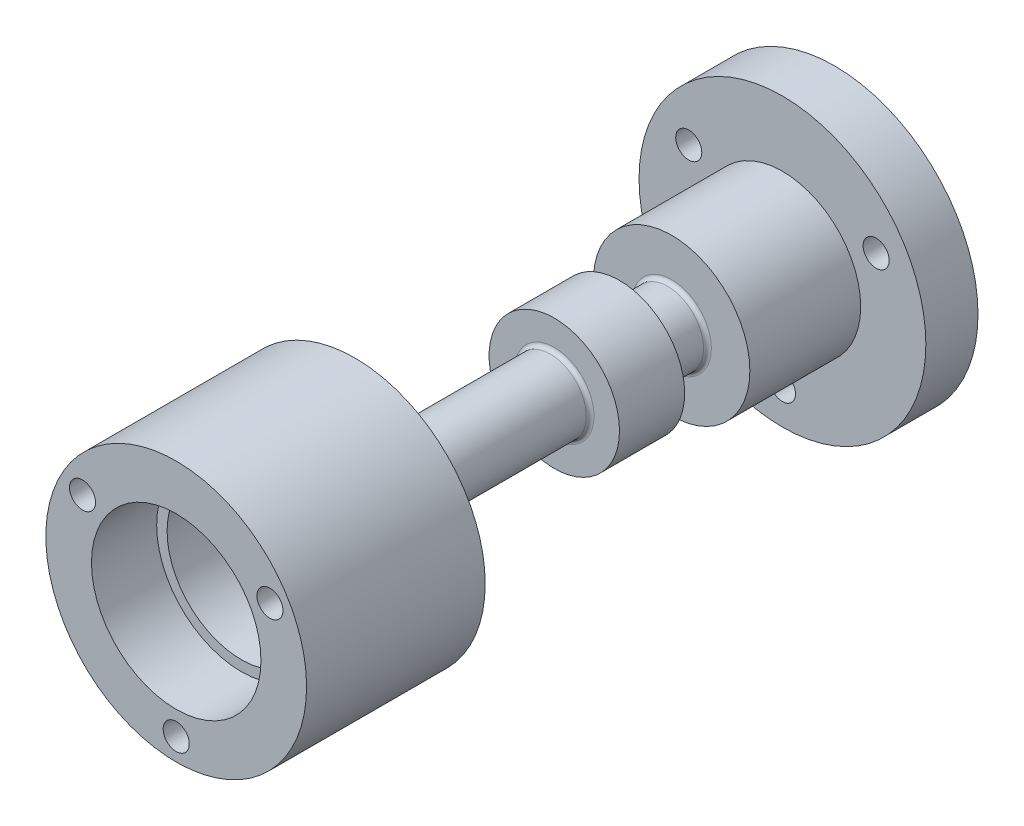
from build123d import *

# Parameters (mm, degrees)
MOUNTING_FLANGE_START                          = -4
SKETCH1_R                                      = 11
MOUNTING_FLANGE_DEPTH                          = 4
SKETCH2_R                                      = 2.75
D5P5_CENTRAL_POST_DEPTH                        = 32.81
CLOSED_FLOOR_BELOW_SHAFT_NOSE_START            = 32.8
SKETCH3_R                                      = 10
CLOSED_FLOOR_BELOW_SHAFT_NOSE_DEPTH            = 2.2
SHAFT_AND_CLIP_CLEARANCE_START                 = 35
SKETCH4_R                                      = 10
SKETCH4_R_2                                    = 5.7
SHAFT_AND_CLIP_CLEARANCE_DEPTH                 = 6.5
LOWER_686ZZ_SEAT_START                         = 41.5
SKETCH5_R                                      = 10
SKETCH5_R_2                                    = 6.5
LOWER_686ZZ_SEAT_DEPTH                         = 5
SKETCH6_R                                      = 1
BASE_THREE_M2_THROUGH_THREAD_MAJOR_ENVEL_DEPTH = 4.01
TOP_CAP_THREE_M2_BLIND_THREAD_MAJOR_ENVE_START = -4.3
SKETCH7_R                                      = 1
TOP_CAP_THREE_M2_BLIND_THREAD_MAJOR_ENVE_DEPTH = 4.3
SKETCH8_R                                      = 6
BENCH_D12_ROOT_TO8P5_DEPTH                     = 8.5
BENCH_D10_MID_COLLAR_12P5_TO17P5_START         = 12.5
SKETCH9_R                                      = 5
BENCH_D10_MID_COLLAR_12P5_TO17P5_DEPTH         = 5
BENCH_STEP_TRANSITIONS_FILLET_R0P30_R          = 0.3


with BuildPart() as part:
    # Sketch1 → Mounting_Flange (new body)
    with BuildSketch(Plane.XY.offset(MOUNTING_FLANGE_START)):
        Circle(SKETCH1_R)
    extrude(amount=MOUNTING_FLANGE_DEPTH)

    # Sketch2 → D5p5_Central_Post (add)
    with BuildSketch(Plane.XY):
        Circle(SKETCH2_R)
    extrude(amount=D5P5_CENTRAL_POST_DEPTH)

    # Sketch3 → Closed_Floor_Below_Shaft_Nose (add)
    with BuildSketch(Plane.XY.offset(CLOSED_FLOOR_BELOW_SHAFT_NOSE_START)):
        Circle(SKETCH3_R)
    extrude(amount=CLOSED_FLOOR_BELOW_SHAFT_NOSE_DEPTH)

    # Sketch4 → Shaft_And_Clip_Clearance (add)
    with BuildSketch(Plane.XY.offset(SHAFT_AND_CLIP_CLEARANCE_START)):
        Circle(SKETCH4_R)
        with Locations(Location((0, 0, 0), (0, 0, 180))):
            Circle(SKETCH4_R_2, mode=Mode.SUBTRACT)
    extrude(amount=SHAFT_AND_CLIP_CLEARANCE_DEPTH)

    # Sketch5 → Lower_686ZZ_Seat (add)
    with BuildSketch(Plane.XY.offset(LOWER_686ZZ_SEAT_START)):
        Circle(SKETCH5_R)
        Circle(SKETCH5_R_2, mode=Mode.SUBTRACT)
    extrude(amount=LOWER_686ZZ_SEAT_DEPTH)

    # Sketch6 → Base_Three_M2_Through_Thread_Major_Envelopes (cut)
    with BuildSketch(Plane(origin=(0, 0, -4), x_dir=(-1, 0, 0), z_dir=(0, 0, -1))):
        with Locations((-7.188010851, 4.15)):
            Circle(SKETCH6_R)
        with Locations((7.188010851, 4.15)):
            Circle(SKETCH6_R)
        with Locations((0, -8.3)):
            Circle(SKETCH6_R)
    extrude(amount=-BASE_THREE_M2_THROUGH_THREAD_MAJOR_ENVEL_DEPTH, mode=Mode.SUBTRACT)

    # Sketch7 → Top_Cap_Three_M2_Blind_Thread_Major_Envelopes (cut)
    with BuildSketch(Plane.XY.offset(46.5).offset(TOP_CAP_THREE_M2_BLIND_THREAD_MAJOR_ENVE_START)):
        with Locations(Location((7.188010851, 4.15, 0), (0, 0, 180))):
            Circle(SKETCH7_R)
        with Locations(Location((-7.188010851, 4.15, 0), (0, 0, 180))):
            Circle(SKETCH7_R)
        with Locations(Location((0, -8.3, 0), (0, 0, 180))):
            Circle(SKETCH7_R)
    extrude(amount=TOP_CAP_THREE_M2_BLIND_THREAD_MAJOR_ENVE_DEPTH, mode=Mode.SUBTRACT)

    # Sketch8 → Bench_D12_Root_To8p5 (add)
    with BuildSketch(Plane.XY):
        Circle(SKETCH8_R)
    extrude(amount=BENCH_D12_ROOT_TO8P5_DEPTH)

    # Sketch9 → Bench_D10_Mid_Collar_12p5_To17p5 (add)
    with BuildSketch(Plane.XY.offset(BENCH_D10_MID_COLLAR_12P5_TO17P5_START)):
        Circle(SKETCH9_R)
    extrude(amount=BENCH_D10_MID_COLLAR_12P5_TO17P5_DEPTH)

    # Bench_Step_Transitions_Fillet_R0p30
    bench_step_transitions_fillet_r0p30_edges = [part.edges().sort_by_distance(p)[0] for p in [
        (-2.75, 0, 8.5),
        (-2.75, 0, 12.5),
        (-2.75, 0, 17.5),
    ]]
    fillet(bench_step_transitions_fillet_r0p30_edges, radius=BENCH_STEP_TRANSITIONS_FILLET_R0P30_R)


solid = part.part
